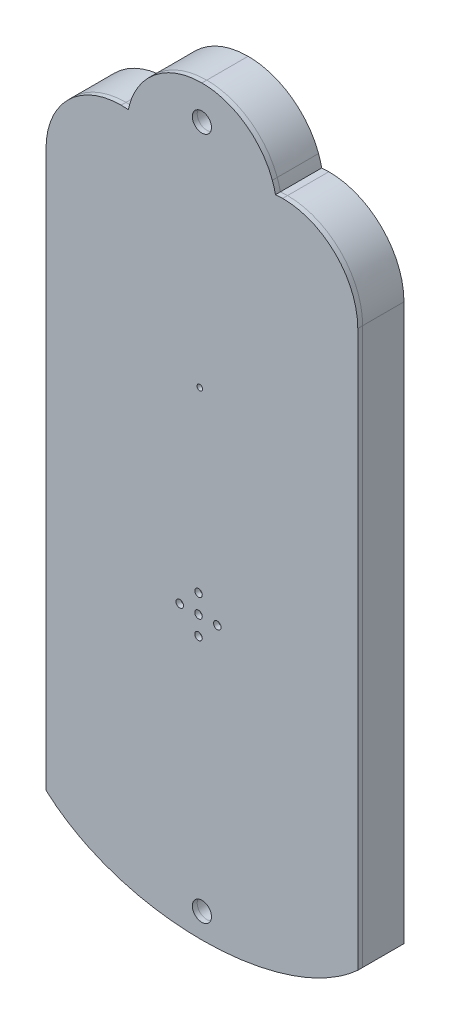
from build123d import *

# Parameters (mm, degrees)
SKETCH_1_R          = 2.55
EXTRUDE_1_DEPTH     = 11
CUT_EXTRUDE_1_DEPTH = 12
SKETCH_3_W          = 3.57346696
SKETCH_3_H          = 6.992054996
EXTRUDE_2_DEPTH     = 9
EXTRUDE_2_2_DEPTH   = 9
SKETCH_3_H_2        = 8.312138205
EXTRUDE_2_3_DEPTH   = 9
SKETCH_3_H_3        = 12.586021109
EXTRUDE_2_4_DEPTH   = 9
EXTRUDE_2_5_DEPTH   = 9
EXTRUDE_2_6_DEPTH   = 9
SKETCH_3_3_W        = 3.57346696
SKETCH_3_3_H        = 19.695806799
SKETCH_3_3_H_2      = 31.259766677
SKETCH_3_3_H_3      = 29.757407966
SKETCH_3_3_H_4      = 25.595250748
SKETCH_3_3_H_5      = 20
EXTRUDE_3_DEPTH     = 2
EXTRUDE_4_DEPTH     = 2
EXTRUDE_4_2_DEPTH   = 2
SKETCH_3_5_R        = 22
SKETCH_3_5_R_2      = 20.25
EXTRUDE_5_DEPTH     = 5
SKETCH_3_6_W        = 3.57346696
SKETCH_3_6_H        = 18.699822207
EXTRUDE_6_DEPTH     = 8.5
SKETCH_3_6_H_2      = 18.12494327
EXTRUDE_6_2_DEPTH   = 8.5
SKETCH_3_6_H_3      = 9.445483778
EXTRUDE_6_3_DEPTH   = 8.5
SKETCH_3_6_H_4      = 6.980918364
EXTRUDE_6_4_DEPTH   = 8.5
SKETCH_3_6_H_5      = 7.401231098
EXTRUDE_6_5_DEPTH   = 8.5
SKETCH_3_7_W        = 3.57346696
SKETCH_3_7_H        = 19.029379681
EXTRUDE_7_DEPTH     = 2
SKETCH_3_7_H_2      = 19.142987079
EXTRUDE_7_2_DEPTH   = 2
SKETCH_3_7_H_3      = 25.175234523
EXTRUDE_7_3_DEPTH   = 2
SKETCH_5_R          = 2.55
SKETCH_5_R_2        = 0.75
SKETCH_5_R_3        = 1
EXTRUDE_8_DEPTH     = 1.3
SKETCH_5_4_W        = 8.848247072
SKETCH_5_4_H        = 2.143421059
EXTRUDE_9_DEPTH     = 9
EXTRUDE_9_2_DEPTH   = 9
SKETCH_5_4_W_2      = 1.816180615
SKETCH_5_4_H_2      = 5.029639524
EXTRUDE_9_3_DEPTH   = 9
SKETCH_5_5_W        = 8.848247072
SKETCH_5_5_H        = 2.382179266
EXTRUDE_10_DEPTH    = 7
SKETCH_5_5_W_2      = 4.568018048
SKETCH_5_5_H_2      = 3
EXTRUDE_10_2_DEPTH  = 7
SKETCH_5_6_W        = 2.735670627
SKETCH_5_6_H        = 5.029639524
EXTRUDE_11_DEPTH    = 6


with BuildPart() as part:
    # 草图1 → 凸台-拉伸1 (new body)
    with BuildSketch(Plane.XY):
        with BuildLine():
            Line((-41.500782935, 68.140791219), (-41.500782935, -79.859208781))
            add(Edge.make_bspline(
                [(-41.500782935, -79.859208781), (-38.389280352, -82.702596808), (-34.568690991, -85.207331949), (-30.197769157, -87.278135781)],
                knots=[11, 11, 11, 11, 12, 12, 12, 12], degree=3))
            add(Edge.make_bspline(
                [(-30.197769157, -87.278135781), (-21.780496549, -91.268051585), (-11.324158051, -93.62813578), (0, -93.62813578)],
                knots=[12, 12, 12, 12, 13, 13, 13, 13], degree=3))
            add(Edge.make_bspline(
                [(0, -93.62813578), (11.324158051, -93.62813578), (21.780496549, -91.268051585), (30.197769157, -87.278135781)],
                knots=[13, 13, 13, 13, 14, 14, 14, 14], degree=3))
            add(Edge.make_bspline(
                [(30.197769157, -87.278135781), (34.568690991, -85.207331949), (38.389280352, -82.702596808), (41.500782935, -79.859208781)],
                knots=[14, 14, 14, 14, 15, 15, 15, 15], degree=3))
            Line((41.500782935, -79.859208781), (41.500782935, 68.140791219))
            add(Edge.make_bspline(
                [(41.500782935, 68.140791219), (41.500782935, 79.186262577), (32.547281215, 88.139764297), (21.501809857, 88.139764297)],
                knots=[0, 0, 0, 0, 1, 1, 1, 1], degree=3))
            add(Edge.make_bspline(
                [(21.501809857, 88.139764297), (20.859751717, 88.139764297), (20.221224801, 88.108026355), (19.593270021, 88.04803863)],
                knots=[1, 1, 1, 1, 2, 2, 2, 2], degree=3))
            add(Edge.make_bspline(
                [(19.593270021, 88.04803863), (19.388674413, 89.04640577), (19.106434966, 90.020075881), (18.760719634, 90.961986519)],
                knots=[2, 2, 2, 2, 3, 3, 3, 3], degree=3))
            add(Edge.make_bspline(
                [(18.760719634, 90.961986519), (15.938497412, 98.581999436), (8.604255165, 104.014764294), (0, 104.014764294)],
                knots=[3, 3, 3, 3, 4, 4, 4, 4], degree=3))
            add(Edge.make_bspline(
                [(0, 104.014764294), (-8.604255165, 104.014764294), (-15.938497412, 98.581999436), (-18.760719634, 90.961986519)],
                knots=[4, 4, 4, 4, 5, 5, 5, 5], degree=3))
            add(Edge.make_bspline(
                [(-18.760719634, 90.961986519), (-19.106456498, 90.020075881), (-19.388674413, 89.04640577), (-19.593270021, 88.04803863)],
                knots=[5, 5, 5, 5, 6, 6, 6, 6], degree=3))
            add(Edge.make_bspline(
                [(-19.593270021, 88.04803863), (-20.221224801, 88.108026355), (-20.856220494, 88.139764297), (-21.498278634, 88.139764297)],
                knots=[6, 6, 6, 6, 7, 7, 7, 7], degree=3))
            add(Edge.make_bspline(
                [(-21.498278634, 88.139764297), (-32.547281215, 88.139764297), (-41.500782935, 79.186262577), (-41.500782935, 68.140791219)],
                knots=[7, 7, 7, 7, 8, 8, 8, 8], degree=3))
        make_face()
        with Locations((0, 95)):
            Circle(SKETCH_1_R, mode=Mode.SUBTRACT)
        with Locations((0, -87)):
            Circle(SKETCH_1_R, mode=Mode.SUBTRACT)
    extrude(amount=EXTRUDE_1_DEPTH)

    # 草图2 → 切除-拉伸1 (cut)
    with BuildSketch(Plane.XY.offset(11)):
        with BuildLine():
            Line((-39, 72.56175603), (-31.85306608, 72.56175603))
            add(Edge.make_bspline(
                [(31.85306608, 72.56175603), (31.85306608, 88.82119273), (0, 88.82119273), (-31.85306608, 88.82119273), (-31.85306608, 72.56175603)],
                knots=[0, 0, 0, 1.570796327, 1.570796327, 3.141592654, 3.141592654, 3.141592654], degree=2, weights=[1, 0.707106781, 1, 0.707106781, 1]))
            Line((31.85306608, 72.56175603), (39, 72.56175603))
            Line((39, 72.56175603), (39, -79.43824397))
            Line((39, -79.43824397), (33.590068299, -79.43824397))
            ThreePointArc((33.590068299, -79.43824397), (33.058093845, -79.485786827), (32.542980448, -79.626908516))
            Line((32.542980448, -79.626908516), (5.947078237, -89.532608684))
            Line((5.947078237, -89.532608684), (5.947078237, -84.669920089))
            ThreePointArc((5.947078237, -84.669920089), (5.06839858, -82.548599745), (2.947078237, -81.669920089))
            Line((2.947078237, -81.669920089), (-3.919139465, -81.669920089))
            ThreePointArc((-3.919139465, -81.669920089), (-6.040459809, -82.548599745), (-6.919139465, -84.669920089))
            Line((-6.919139465, -84.669920089), (-6.919139465, -88.936950457))
            Line((-6.919139465, -88.936950457), (-32.753744515, -79.616285846))
            ThreePointArc((-32.753744515, -79.616285846), (-33.255075458, -79.483089628), (-33.771856663, -79.43824397))
            Line((-33.771856663, -79.43824397), (-39, -79.43824397))
            Line((-39, -79.43824397), (-39, 72.56175603))
        make_face()
    extrude(amount=-CUT_EXTRUDE_1_DEPTH, mode=Mode.SUBTRACT)


with BuildPart() as body_2:
    # 草图3 → 凸台-拉伸2 (new body)
    with BuildSketch(Plane.XY.offset(11)):
        with Locations((37.21326652, 69.065728532)):
            Rectangle(SKETCH_3_W, SKETCH_3_H)
    extrude(amount=-EXTRUDE_2_DEPTH)


with BuildPart() as body_3:
    # 草图3 → Extrude 2 2 (new body)
    with BuildSketch(Plane.XY.offset(11)):
        with Locations((-37.21326652, 69.065728532)):
            Rectangle(SKETCH_3_W, SKETCH_3_H)
    extrude(amount=-EXTRUDE_2_2_DEPTH)


with BuildPart() as body_4:
    # 草图3 → Extrude 2 3 (new body)
    with BuildSketch(Plane.XY.offset(11)):
        with Locations((-37.21326652, 41.717825133)):
            Rectangle(SKETCH_3_W, SKETCH_3_H_2)
    extrude(amount=-EXTRUDE_2_3_DEPTH)


with BuildPart() as body_5:
    # 草图3 → Extrude 2 4 (new body)
    with BuildSketch(Plane.XY.offset(11)):
        with Locations((37.21326652, 28.016923803)):
            Rectangle(SKETCH_3_W, SKETCH_3_H_3)
    extrude(amount=-EXTRUDE_2_4_DEPTH)


with BuildPart() as body_6:
    # 草图3 → Extrude 2 5 (new body)
    with BuildSketch(Plane.XY.offset(11)):
        Polygon((35.42653304, -14.104654672), (35.42653304, -17.43824397), (39, -17.43824397), (39, -8.033494718), (35.42653304, -8.033494718), align=None)
    extrude(amount=-EXTRUDE_2_5_DEPTH)


with BuildPart() as body_7:
    # 草图3 → Extrude 2 6 (new body)
    with BuildSketch(Plane.XY.offset(11)):
        Polygon((-35.42653304, -17.43824397), (-35.42653304, -14.104654672), (-35.42653304, -8.033494718), (-39, -8.033494718), (-39, -17.43824397), align=None)
    extrude(amount=-EXTRUDE_2_6_DEPTH)


with BuildPart() as body_8:
    # 草图3<3> → 凸台-拉伸3 (new body)
    with BuildSketch(Plane.XY.offset(11)):
        with Locations((-37.21326652, 55.721797635)):
            Rectangle(SKETCH_3_3_W, SKETCH_3_3_H)
        with Locations((37.21326652, 49.939817696)):
            Rectangle(SKETCH_3_3_W, SKETCH_3_3_H_2)
        with Locations((37.21326652, 6.845209265)):
            Rectangle(SKETCH_3_3_W, SKETCH_3_3_H_3)
        with Locations((-37.21326652, 4.764130656)):
            Rectangle(SKETCH_3_3_W, SKETCH_3_3_H_4)
        with Locations((-37.21326652, 27.56175603)):
            Rectangle(SKETCH_3_3_W, SKETCH_3_3_H_5)
    extrude(amount=-EXTRUDE_3_DEPTH)


with BuildPart() as body_9:
    # 草图3<4> → 凸台-拉伸4 (new body)
    with BuildSketch(Plane.XY.offset(11)):
        with BuildLine():
            Line((35.42653304, -21.183340916), (35.42653304, -17.43824397))
            Line((35.42653304, -17.43824397), (35.42653304, -14.104654672))
            Line((35.42653304, -14.104654672), (32.827882873, -14.104654672))
            Line((32.827882873, -14.104654672), (20.541921245, -14.104654672))
            ThreePointArc((20.541921245, -14.104654672), (20.957005378, -16.542142572), (21.09595179, -19.010813469))
            ThreePointArc((21.09595179, -19.010813469), (21.069052169, -20.098407004), (20.98841909, -21.183340916))
            Line((20.98841909, -21.183340916), (32.92605448, -21.183340916))
            Line((32.92605448, -21.183340916), (35.42653304, -21.183340916))
        make_face()
    extrude(amount=-EXTRUDE_4_DEPTH)


with BuildPart() as body_10:
    # 草图3<4> → Extrude 4 2 (new body)
    with BuildSketch(Plane.XY.offset(11)):
        with BuildLine():
            ThreePointArc((-22.796515511, -21.183340916), (-22.860413457, -17.625885611), (-22.350017665, -14.104654672))
            Line((-22.350017665, -14.104654672), (-30.878249286, -14.104654672))
            Line((-30.878249286, -14.104654672), (-35.42653304, -14.104654672))
            Line((-35.42653304, -14.104654672), (-35.42653304, -17.43824397))
            Line((-35.42653304, -17.43824397), (-35.42653304, -21.183340916))
            Line((-35.42653304, -21.183340916), (-30.78007768, -21.183340916))
            Line((-30.78007768, -21.183340916), (-22.796515511, -21.183340916))
        make_face()
    extrude(amount=-EXTRUDE_4_2_DEPTH)

    # 草图3<5> → 凸台-拉伸5 (add)
    with BuildSketch(Plane.XY.offset(11)):
        with Locations((-0.90404821, -19.010813469)):
            Circle(SKETCH_3_5_R)
        with Locations((-0.90404821, -19.010813469)):
            Circle(SKETCH_3_5_R_2, mode=Mode.SUBTRACT)
    extrude(amount=-EXTRUDE_5_DEPTH)


with BuildPart() as body_11:
    # 草图3<6> → 凸台-拉伸6 (new body)
    with BuildSketch(Plane.XY.offset(11)):
        with Locations((37.21326652, -26.788155074)):
            Rectangle(SKETCH_3_6_W, SKETCH_3_6_H)
    extrude(amount=-EXTRUDE_6_DEPTH)


with BuildPart() as body_12:
    # 草图3<6> → Extrude 6 2 (new body)
    with BuildSketch(Plane.XY.offset(11)):
        with Locations((37.21326652, -70.375772335)):
            Rectangle(SKETCH_3_6_W, SKETCH_3_6_H_2)
    extrude(amount=-EXTRUDE_6_2_DEPTH)


with BuildPart() as body_13:
    # 草图3<6> → Extrude 6 3 (new body)
    with BuildSketch(Plane.XY.offset(11)):
        with Locations((-37.21326652, -22.160985859)):
            Rectangle(SKETCH_3_6_W, SKETCH_3_6_H_3)
    extrude(amount=-EXTRUDE_6_3_DEPTH)


with BuildPart() as body_14:
    # 草图3<6> → Extrude 6 4 (new body)
    with BuildSketch(Plane.XY.offset(11)):
        with Locations((-37.21326652, -49.403566611)):
            Rectangle(SKETCH_3_6_W, SKETCH_3_6_H_4)
    extrude(amount=-EXTRUDE_6_4_DEPTH)


with BuildPart() as body_15:
    # 草图3<6> → Extrude 6 5 (new body)
    with BuildSketch(Plane.XY.offset(11)):
        with Locations((-37.21326652, -75.737628421)):
            Rectangle(SKETCH_3_6_W, SKETCH_3_6_H_5)
    extrude(amount=-EXTRUDE_6_5_DEPTH)


with BuildPart() as body_16:
    # 草图3<7> → 凸台-拉伸7 (new body)
    with BuildSketch(Plane.XY.offset(11)):
        with Locations((-37.21326652, -36.398417589)):
            Rectangle(SKETCH_3_7_W, SKETCH_3_7_H)
    extrude(amount=-EXTRUDE_7_DEPTH)


with BuildPart() as body_17:
    # 草图3<7> → Extrude 7 2 (new body)
    with BuildSketch(Plane.XY.offset(11)):
        with Locations((-37.21326652, -62.465519333)):
            Rectangle(SKETCH_3_7_W, SKETCH_3_7_H_2)
    extrude(amount=-EXTRUDE_7_2_DEPTH)


with BuildPart() as body_18:
    # 草图3<7> → Extrude 7 3 (new body)
    with BuildSketch(Plane.XY.offset(11)):
        with Locations((37.21326652, -48.725683438)):
            Rectangle(SKETCH_3_7_W, SKETCH_3_7_H_3)
    extrude(amount=-EXTRUDE_7_3_DEPTH)


with BuildPart() as body_19:
    # 草图5 → 凸台-拉伸8 (new body)
    with BuildSketch(Plane.XY.offset(11)):
        with BuildLine():
            Line((-41.500782935, 68.140791219), (-41.500782935, -79.859208781))
            add(Edge.make_bspline(
                [(-41.500782935, -79.859208781), (-38.389280352, -82.702596808), (-34.568690991, -85.207331949), (-30.197769157, -87.278135781)],
                knots=[11, 11, 11, 11, 12, 12, 12, 12], degree=3))
            add(Edge.make_bspline(
                [(-30.197769157, -87.278135781), (-21.780496549, -91.268051585), (-11.324158051, -93.62813578), (0, -93.62813578)],
                knots=[12, 12, 12, 12, 13, 13, 13, 13], degree=3))
            add(Edge.make_bspline(
                [(0, -93.62813578), (11.324158051, -93.62813578), (21.780496549, -91.268051585), (30.197769157, -87.278135781)],
                knots=[13, 13, 13, 13, 14, 14, 14, 14], degree=3))
            add(Edge.make_bspline(
                [(30.197769157, -87.278135781), (34.568690991, -85.207331949), (38.389280352, -82.702596808), (41.500782935, -79.859208781)],
                knots=[14, 14, 14, 14, 15, 15, 15, 15], degree=3))
            Line((41.500782935, -79.859208781), (41.500782935, 68.140791219))
            add(Edge.make_bspline(
                [(41.500782935, 68.140791219), (41.500782935, 79.186262577), (32.547281215, 88.139764297), (21.501809857, 88.139764297)],
                knots=[0, 0, 0, 0, 1, 1, 1, 1], degree=3))
            add(Edge.make_bspline(
                [(21.501809857, 88.139764297), (20.859751717, 88.139764297), (20.221224801, 88.108026355), (19.593270021, 88.04803863)],
                knots=[1, 1, 1, 1, 2, 2, 2, 2], degree=3))
            add(Edge.make_bspline(
                [(19.593270021, 88.04803863), (19.388674413, 89.04640577), (19.106434966, 90.020075881), (18.760719634, 90.961986519)],
                knots=[2, 2, 2, 2, 3, 3, 3, 3], degree=3))
            add(Edge.make_bspline(
                [(18.760719634, 90.961986519), (15.938497412, 98.581999436), (8.604255165, 104.014764294), (0, 104.014764294)],
                knots=[3, 3, 3, 3, 4, 4, 4, 4], degree=3))
            add(Edge.make_bspline(
                [(0, 104.014764294), (-8.604255165, 104.014764294), (-15.938497412, 98.581999436), (-18.760719634, 90.961986519)],
                knots=[4, 4, 4, 4, 5, 5, 5, 5], degree=3))
            add(Edge.make_bspline(
                [(-18.760719634, 90.961986519), (-19.106456498, 90.020075881), (-19.388674413, 89.04640577), (-19.593270021, 88.04803863)],
                knots=[5, 5, 5, 5, 6, 6, 6, 6], degree=3))
            add(Edge.make_bspline(
                [(-19.593270021, 88.04803863), (-20.221224801, 88.108026355), (-20.856220494, 88.139764297), (-21.498278634, 88.139764297)],
                knots=[6, 6, 6, 6, 7, 7, 7, 7], degree=3))
            add(Edge.make_bspline(
                [(-21.498278634, 88.139764297), (-32.547281215, 88.139764297), (-41.500782935, 79.186262577), (-41.500782935, 68.140791219)],
                knots=[7, 7, 7, 7, 8, 8, 8, 8], degree=3))
        make_face()
        with Locations((0, 95)):
            Circle(SKETCH_5_R, mode=Mode.SUBTRACT)
        with Locations((0, -87)):
            Circle(SKETCH_5_R, mode=Mode.SUBTRACT)
        with Locations((-0.543837801, 33.493429894)):
            Circle(SKETCH_5_R_2, mode=Mode.SUBTRACT)
        with Locations((-0.90404821, -19.010813469)):
            Circle(SKETCH_5_R_3, mode=Mode.SUBTRACT)
        with Locations((-0.90404821, -14.010813469)):
            Circle(SKETCH_5_R_3, mode=Mode.SUBTRACT)
        with Locations((4.09595179, -19.010813469)):
            Circle(SKETCH_5_R_3, mode=Mode.SUBTRACT)
        with Locations((-0.90404821, -24.010813469)):
            Circle(SKETCH_5_R_3, mode=Mode.SUBTRACT)
        with Locations((-5.90404821, -19.010813469)):
            Circle(SKETCH_5_R_3, mode=Mode.SUBTRACT)
    extrude(amount=EXTRUDE_8_DEPTH)


with BuildPart() as body_20:
    # 草图5<4> → 凸台-拉伸9 (new body)
    with BuildSketch(Plane.XY.offset(11)):
        with Locations((31.002409504, 47.63346656)):
            Rectangle(SKETCH_5_4_W, SKETCH_5_4_H)
    extrude(amount=-EXTRUDE_9_DEPTH)


with BuildPart() as body_21:
    # 草图5<4> → Extrude 9 2 (new body)
    with BuildSketch(Plane.XY.offset(11)):
        Polygon((-5.537972227, 6.089696412), (-5.537972227, 4.647534595), (-11.92217089, 4.647534595), (-11.92217089, 14.766706626), (-10.105990275, 14.766706626), (-10.105990275, 6.089696412), align=None)
    extrude(amount=-EXTRUDE_9_2_DEPTH)


with BuildPart() as body_22:
    # 草图5<4> → Extrude 9 3 (new body)
    with BuildSketch(Plane.XY.offset(11)):
        with Locations((-11.014080583, 39.338697772)):
            Rectangle(SKETCH_5_4_W_2, SKETCH_5_4_H_2)
    extrude(amount=-EXTRUDE_9_3_DEPTH)


with BuildPart() as body_23:
    # 草图5<5> → 凸台-拉伸10 (new body)
    with BuildSketch(Plane.XY.offset(11)):
        with Locations((31.002409504, 45.370666397)):
            Rectangle(SKETCH_5_5_W, SKETCH_5_5_H)
    extrude(amount=-EXTRUDE_10_DEPTH)


with BuildPart() as body_24:
    # 草图5<5> → Extrude 10 2 (new body)
    with BuildSketch(Plane.XY.offset(11)):
        with Locations((-7.821981251, 7.589696412)):
            Rectangle(SKETCH_5_5_W_2, SKETCH_5_5_H_2)
    extrude(amount=-EXTRUDE_10_2_DEPTH)


with BuildPart() as body_25:
    # 草图5<6> → 凸台-拉伸11 (new body)
    with BuildSketch(Plane.XY.offset(11)):
        with Locations((-8.738154962, 39.338697772)):
            Rectangle(SKETCH_5_6_W, SKETCH_5_6_H)
    extrude(amount=-EXTRUDE_11_DEPTH)


solid = Compound([part.part, body_2.part, body_3.part, body_4.part, body_5.part, body_6.part, body_7.part, body_8.part, body_9.part, body_10.part, body_11.part, body_12.part, body_13.part, body_14.part, body_15.part, body_16.part, body_17.part, body_18.part, body_19.part, body_20.part, body_21.part, body_22.part, body_23.part, body_24.part, body_25.part])
